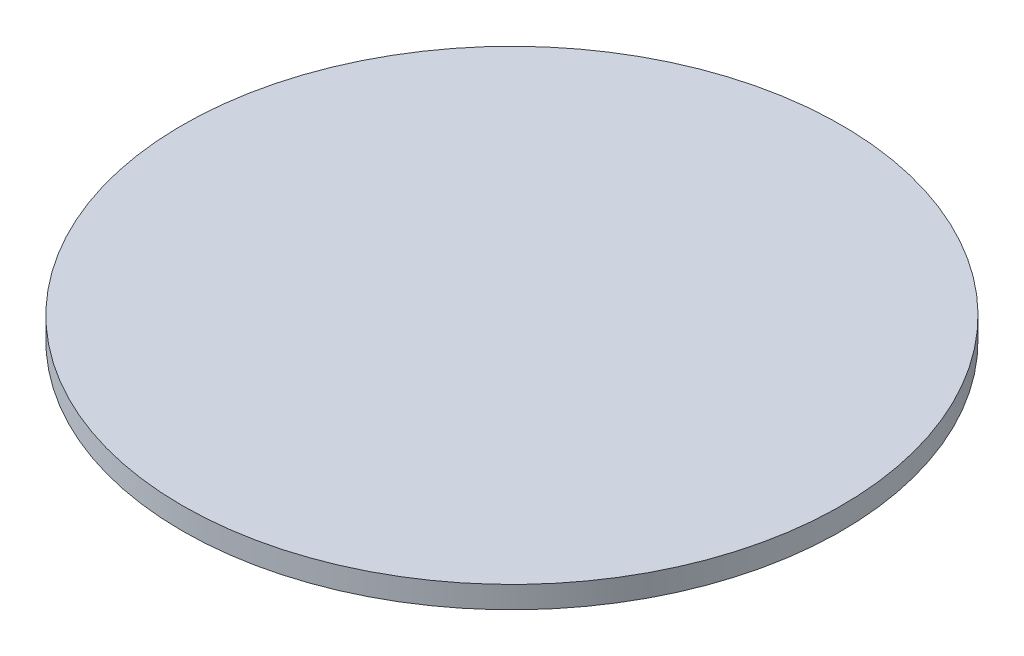
from build123d import *

# Parameters (mm, degrees)
SKETCH1_R           = 30
BOSS_EXTRUDE1_DEPTH = 2
SKETCH2_R           = 3.5
SKETCH2_R_2         = 2.5
BOSS_EXTRUDE2_DEPTH = 10
FILLET1_R           = 1
FILLET2_R           = 1


with BuildPart() as part:
    # Sketch1 → Boss-Extrude1 (new body)
    with BuildSketch(Plane(origin=(0, 0, 0), x_dir=(1, 0, 0), z_dir=(0, 1, 0))):
        with Locations(Location((0, 0, 0), (0, 0, 270))):
            Circle(SKETCH1_R)
    extrude(amount=BOSS_EXTRUDE1_DEPTH)

    # Sketch2 → Boss-Extrude2 (add)
    with BuildSketch(Plane.XZ):
        with Locations(Location((0, 0, 0), (0, 0, 90))):
            Circle(SKETCH2_R)
        with Locations(Location((0, 0, 0), (0, 0, 270))):
            Circle(SKETCH2_R_2, mode=Mode.SUBTRACT)
    extrude(amount=BOSS_EXTRUDE2_DEPTH)

    # Fillet1
    fillet1_edges = [part.edges().sort_by_distance(p)[0] for p in [
        (0, 0, -3.5),
    ]]
    fillet(fillet1_edges, radius=FILLET1_R)

    # Fillet2
    fillet2_edges = [part.edges().sort_by_distance(p)[0] for p in [
        (0, 0, 2.5),
    ]]
    fillet(fillet2_edges, radius=FILLET2_R)


solid = part.part
